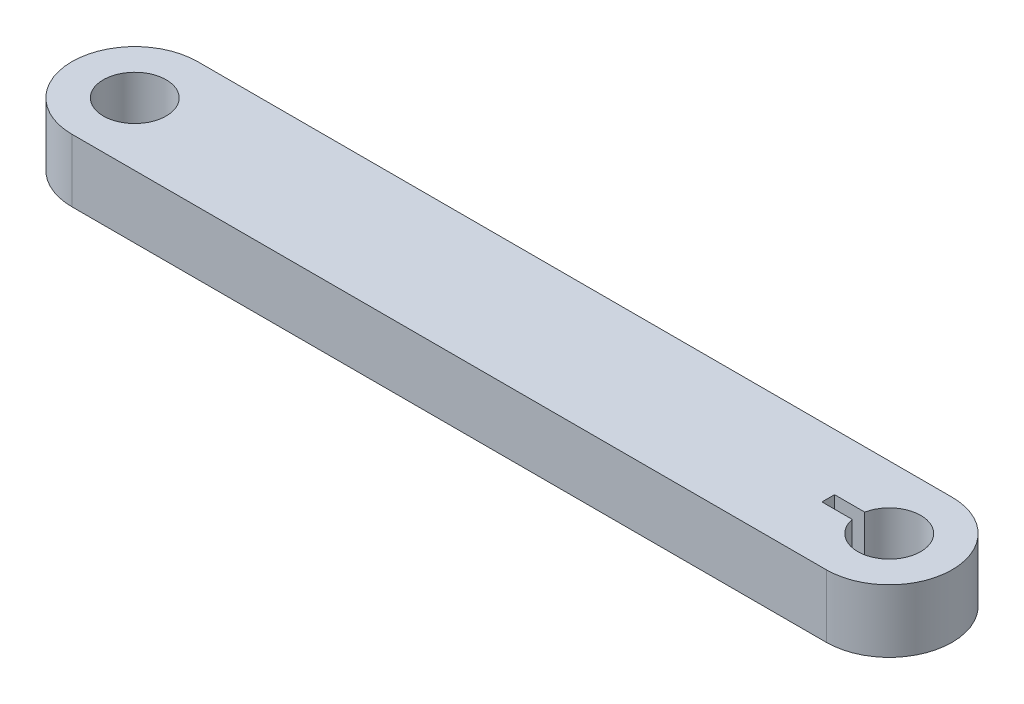
from build123d import *

# Parameters (mm, degrees)
BOSS_EXTRUDE1_DEPTH = 6.35
CUT_EXTRUDE2_DEPTH  = 84.037024874
SKETCH4_R           = 3.175
CUT_EXTRUDE3_DEPTH  = 84.037024874


with BuildPart() as part:
    # Sketch1 → Boss-Extrude1 (new body)
    with BuildSketch(Plane(origin=(0, 0, 0), x_dir=(1, 0, 0), z_dir=(0, 1, 0))):
        with BuildLine():
            Line((0, -6.35), (-76.2, -6.35))
            ThreePointArc((-76.2, -6.35), (-82.55, 0), (-76.2, 6.35))
            Line((-76.2, 6.35), (0, 6.35))
            ThreePointArc((0, 6.35), (6.35, 0), (0, -6.35))
        make_face()
    extrude(amount=BOSS_EXTRUDE1_DEPTH)

    # Sketch3 → Cut-Extrude2 (cut, through all)
    with BuildSketch(Plane(origin=(0, 6.35, 0), x_dir=(1, 0, 0), z_dir=(0, 1, 0))):
        with BuildLine():
            Line((-3.110851973, 0.635), (-6.158851973, 0.635))
            Line((-6.158851973, 0.635), (-6.158851973, -0.635))
            Line((-6.158851973, -0.635), (-3.110851973, -0.635))
            ThreePointArc((-3.110851973, -0.635), (3.175, 0), (-3.110851973, 0.635))
        make_face()
    extrude(amount=-CUT_EXTRUDE2_DEPTH, mode=Mode.SUBTRACT)

    # Sketch4 → Cut-Extrude3 (cut, through all)
    with BuildSketch(Plane(origin=(0, 6.35, 0), x_dir=(1, 0, 0), z_dir=(0, 1, 0))):
        with Locations(Location((-76.2, 0, 0), (0, 0, 270))):
            Circle(SKETCH4_R)
    extrude(amount=-CUT_EXTRUDE3_DEPTH, mode=Mode.SUBTRACT)


solid = part.part
